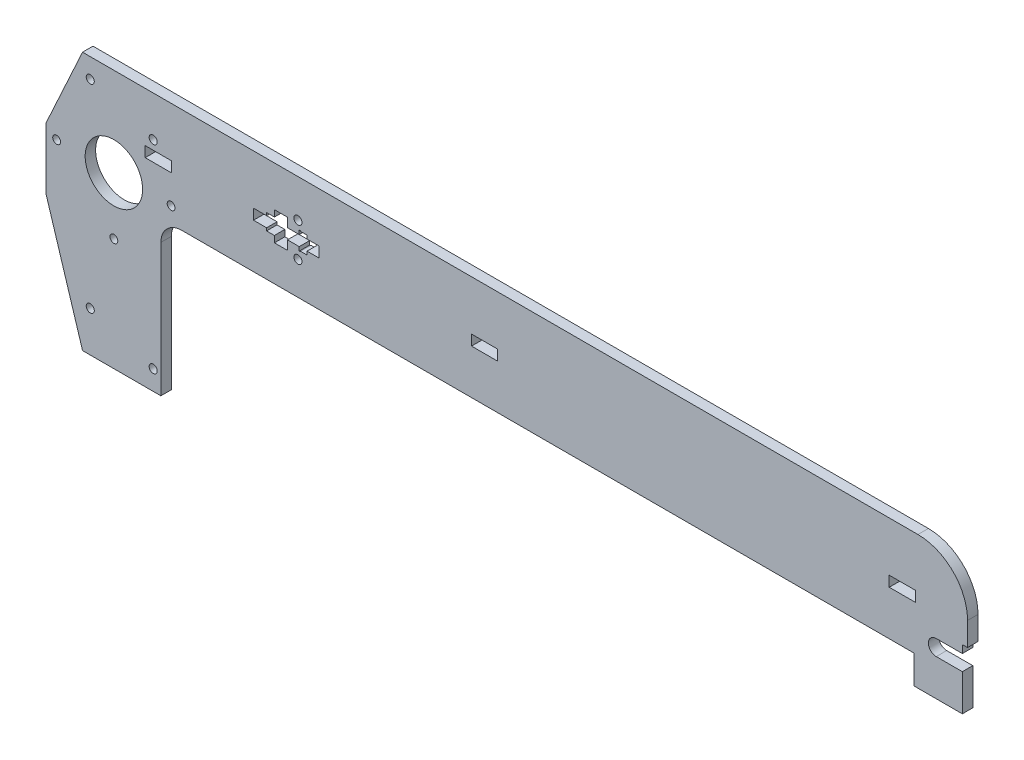
from build123d import *

# Parameters (mm, degrees)
SKETCH1_R           = 1.5
SKETCH1_R_2         = 11
SKETCH1_R_3         = 1.55
SKETCH1_W           = 10
SKETCH1_H           = 4
BOSS_EXTRUDE1_DEPTH = 4
FILLET1_R           = 8


with BuildPart() as part:
    # Sketch1 → Boss-Extrude1 (new body)
    with BuildSketch(Plane.XY):
        with BuildLine():
            Line((-12, 34), (-26, 3.5))
            Line((-26, 3.5), (-26, -20))
            Line((-26, -20), (-12, -65))
            Line((-12, -65), (18, -65))
            Line((18, -65), (18, -45))
            Line((18, -45), (18, -6.1))
            Line((18, -6.1), (306.5, -6.1))
            Line((306.5, -6.1), (306.5, -17))
            Line((306.5, -17), (325, -17))
            Line((325, -17), (325, -3))
            Line((325, -3), (315, -3))
            ThreePointArc((315, -3), (312, 0), (315, 3))
            Line((315, 3), (325, 3))
            Line((325, 3), (325, 6))
            Line((325, 6), (327, 6))
            Line((327, 6), (327, 15))
            ThreePointArc((327, 15), (321.435028843, 28.435028843), (308, 34))
            Line((308, 34), (-12, 34))
        make_face()
        with Locations((21.920310217, 0)):
            Circle(SKETCH1_R, mode=Mode.SUBTRACT)
        with Locations((0, -21.920310217)):
            Circle(SKETCH1_R, mode=Mode.SUBTRACT)
        with Locations((-21.920310217, 0)):
            Circle(SKETCH1_R, mode=Mode.SUBTRACT)
        Circle(SKETCH1_R_2, mode=Mode.SUBTRACT)
        with Locations((-9.05, 26.5)):
            Circle(SKETCH1_R_3, mode=Mode.SUBTRACT)
        with Locations((15.05, 18.5)):
            Circle(SKETCH1_R_3, mode=Mode.SUBTRACT)
        with Locations((-9.05, -49.5)):
            Circle(SKETCH1_R_3, mode=Mode.SUBTRACT)
        with Locations((15.05, -57.5)):
            Circle(SKETCH1_R_3, mode=Mode.SUBTRACT)
        with Locations((70.5, 6.5)):
            Circle(SKETCH1_R_3, mode=Mode.SUBTRACT)
        with Locations((70.5, 19.5)):
            Circle(SKETCH1_R_3, mode=Mode.SUBTRACT)
        with Locations((17, 13)):
            Rectangle(SKETCH1_W, SKETCH1_H, mode=Mode.SUBTRACT)
        with Locations((142, 13)):
            Rectangle(SKETCH1_W, SKETCH1_H, mode=Mode.SUBTRACT)
        with Locations((302, 13)):
            Rectangle(SKETCH1_W, SKETCH1_H, mode=Mode.SUBTRACT)
        Polygon((53.5, 11), (58.5, 11), (58.5, 9.95), (61.5, 9.95), (61.5, 7.5), (66.5, 7.5), (66.5, 11), (71, 11), (71, 9.5), (71.5, 9.5), (71.5, 9.7), (74, 9.7), (74, 11), (78.5, 11), (78.5, 15), (74, 15), (74, 16.3), (71.5, 16.3), (71.5, 16.5), (71, 16.5), (71, 15), (66.5, 15), (66.5, 18.5), (61.5, 18.5), (61.5, 16.05), (58.5, 16.05), (58.5, 15), (53.5, 15), align=None, mode=Mode.SUBTRACT)
    extrude(amount=BOSS_EXTRUDE1_DEPTH)

    # Fillet1
    fillet1_edges = [part.edges().sort_by_distance(p)[0] for p in [
        (18, -6.1, 2),
    ]]
    fillet(fillet1_edges, radius=FILLET1_R)


solid = part.part
